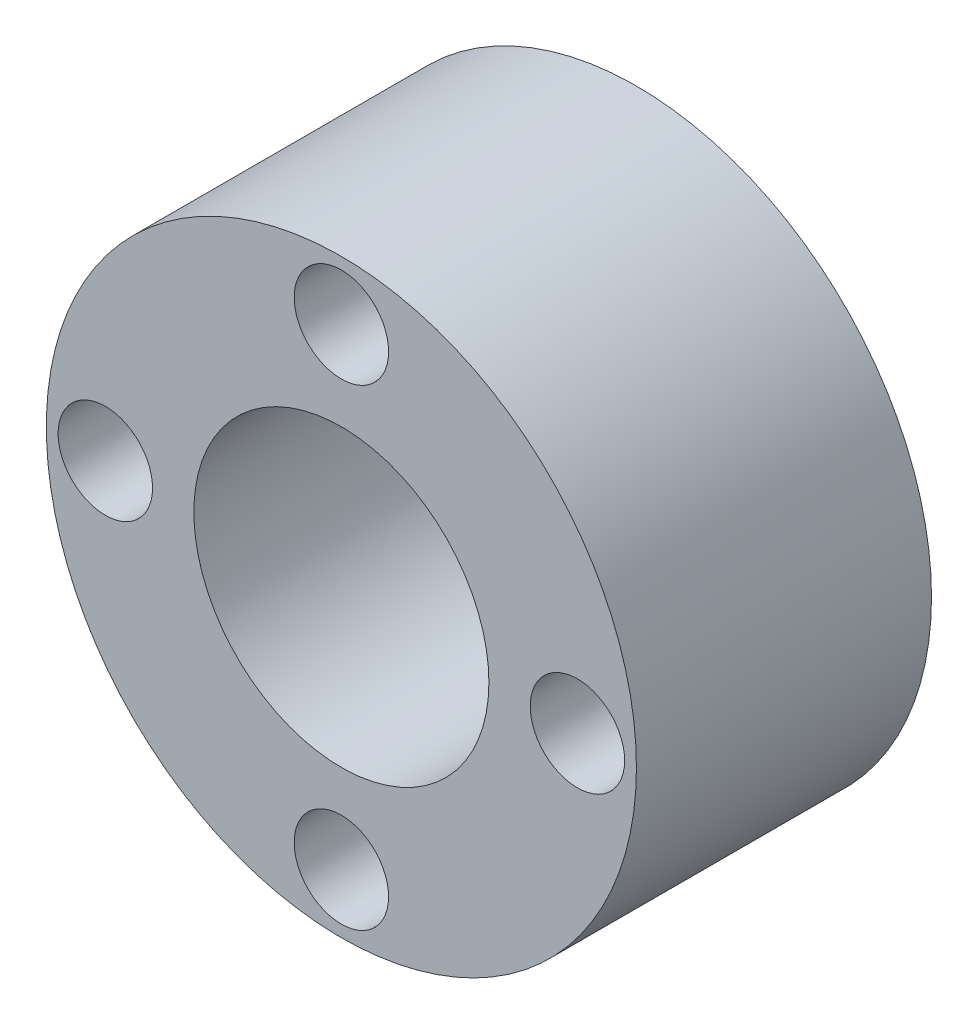
from build123d import *

# Parameters (mm, degrees)
SKETCH_1_R      = 5
SKETCH_1_R_2    = 2.5
SKETCH_1_R_3    = 0.8
EXTRUDE_1_DEPTH = 5


with BuildPart() as part:
    # 草图1 → 凸台-拉伸1 (new body)
    with BuildSketch(Plane.XY):
        Circle(SKETCH_1_R)
        Circle(SKETCH_1_R_2, mode=Mode.SUBTRACT)
        with Locations((0, 4)):
            Circle(SKETCH_1_R_3, mode=Mode.SUBTRACT)
        with Locations((4, 0)):
            Circle(SKETCH_1_R_3, mode=Mode.SUBTRACT)
        with Locations((0, -4)):
            Circle(SKETCH_1_R_3, mode=Mode.SUBTRACT)
        with Locations((-4, 0)):
            Circle(SKETCH_1_R_3, mode=Mode.SUBTRACT)
    extrude(amount=EXTRUDE_1_DEPTH)


solid = part.part
